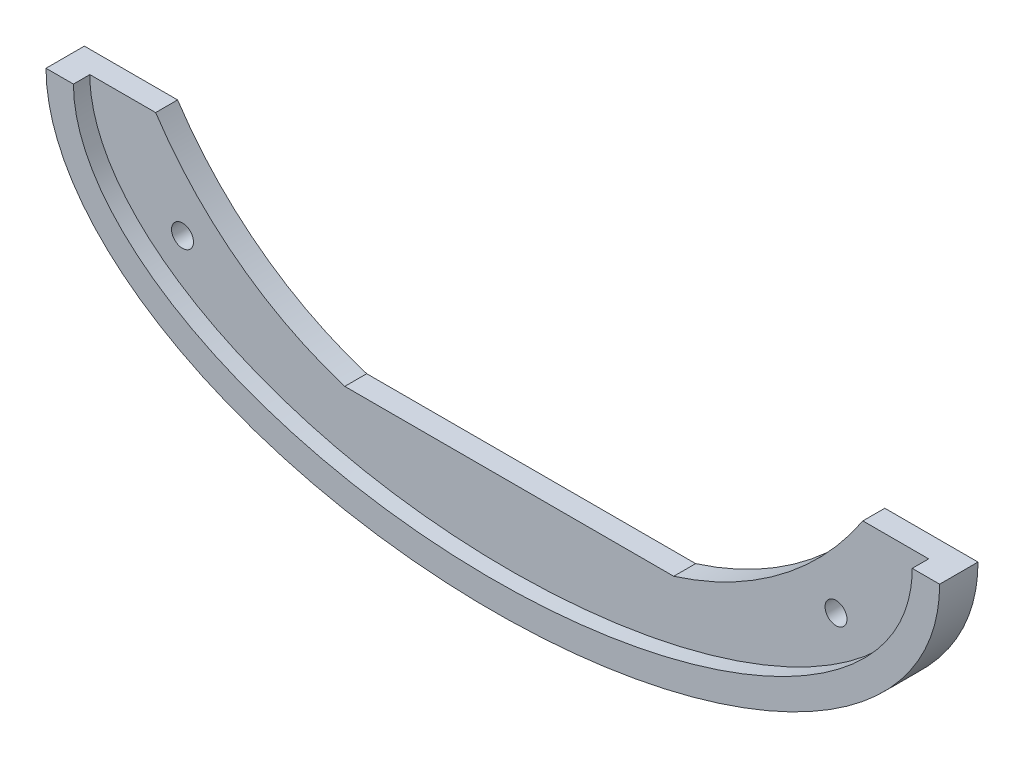
from build123d import *

# Parameters (mm, degrees)
CROQUIS1_R                 = 2
SALIENTE_EXTRUIR1_DEPTH    = 4
CROQUIS2_R                 = 2
SALIENTE_EXTRUIR2_DEPTH    = 4
SALIENTE_EXTRUIR3_START    = -11
SALIENTE_EXTRUIR3_DEPTH    = 11
SALIENTE_EXTRUIR4_DEPTH    = 4
CROQUIS5_W                 = 81.51
CROQUIS5_H                 = 4
SALIENTE_EXTRUIR5_DEPTH    = 45
CROQUIS6_R                 = 8.15
CROQUIS6_R_2               = 8.125
CROQUIS6_R_3               = 2.65
CORTAR_EXTRUIR1_DEPTH      = 25
SALIENTE_EXTRUIR9_START    = 2
CROQUIS17_RX               = 3.839992974
CROQUIS17_RY               = 1.30664232
SALIENTE_EXTRUIR9_DEPTH    = 2
CORTAR_EXTRUIR9_DEPTH      = 104.166128328
CORTAR_EXTRUIR9_DEPTH_BACK = 104.166128328
CROQUIS20_W                = 49.659393266
CROQUIS20_H                = 45
SALIENTE_EXTRUIR11_START   = -4
CROQUIS21_R                = 2
SALIENTE_EXTRUIR11_DEPTH   = 4


with BuildPart() as part:
    # Croquis1 → Saliente-Extruir1 (new body)
    with BuildSketch(Plane.XY):
        with BuildLine():
            Line((0, 14), (30, 14))
            ThreePointArc((30, 14), (49.490442899, 24.027104614), (64.5, 40))
            Line((64.5, 40), (76.5, 40))
            add(Edge.make_bspline(
                [(-76.5, 40), (-76.5, 0), (0, 0), (76.5, 0), (76.5, 40)],
                knots=[3.141592654, 3.141592654, 3.141592654, 4.71238898, 4.71238898, 6.283185307, 6.283185307, 6.283185307], degree=2, weights=[1, 0.707106781, 1, 0.707106781, 1]))
            Line((-76.5, 40), (-64.5, 40))
            ThreePointArc((-64.5, 40), (-49.490442899, 24.027104614), (-30, 14))
            Line((-30, 14), (0, 14))
        make_face()
        with Locations(Location((7.25, 8, 0), (0, 0, 180))):
            Circle(CROQUIS1_R, mode=Mode.SUBTRACT)
        with Locations(Location((59.6, 23, 0), (0, 0, 180))):
            Circle(CROQUIS1_R, mode=Mode.SUBTRACT)
        with Locations((-7.25, 8)):
            Circle(CROQUIS1_R, mode=Mode.SUBTRACT)
        with Locations((-59.6, 23)):
            Circle(CROQUIS1_R, mode=Mode.SUBTRACT)
    extrude(amount=SALIENTE_EXTRUIR1_DEPTH)



with BuildPart() as body_2:
    # Croquis2 → Saliente-Extruir2 (new body)
    with BuildSketch(Plane(origin=(0, 0, -3), x_dir=(-1, 0, 0), z_dir=(0, 0, -1))):
        with BuildLine():
            Line((64.5, 40), (76.5, 40))
            add(Edge.make_bspline(
                [(-76.5, 40), (-76.5, 0), (0, 0), (76.5, 0), (76.5, 40)],
                knots=[0, 0, 0, 1.570796327, 1.570796327, 3.141592654, 3.141592654, 3.141592654], degree=2, weights=[1, 0.707106781, 1, 0.707106781, 1]))
            Line((-76.5, 40), (-64.5, 40))
            ThreePointArc((-64.5, 40), (-49.490442899, 24.027104614), (-30, 14))
            Line((-30, 14), (30, 14))
            ThreePointArc((30, 14), (49.490442899, 24.027104614), (64.5, 40))
        make_face()
        with Locations((-59.6, 23)):
            Circle(CROQUIS2_R, mode=Mode.SUBTRACT)
        with Locations(Location((7.25, 8, 0), (0, 0, 180))):
            Circle(CROQUIS2_R, mode=Mode.SUBTRACT)
        with Locations((-7.25, 8)):
            Circle(CROQUIS2_R, mode=Mode.SUBTRACT)
        with Locations(Location((59.6, 23, 0), (0, 0, 180))):
            Circle(CROQUIS2_R, mode=Mode.SUBTRACT)
    extrude(amount=SALIENTE_EXTRUIR2_DEPTH)


with BuildPart() as part_1:
    add(part.part)

    add(body_2.part)  # Saliente-Extruir3 merges body 2
    # Croquis3 → Saliente-Extruir3 (add)
    with BuildSketch(Plane.XY.offset(4).offset(SALIENTE_EXTRUIR3_START)):
        with BuildLine():
            Line((-81.5, 40), (-76.5, 40))
            add(Edge.make_bspline(
                [(-76.5, 40), (-76.5, 0), (0, 0), (76.5, 0), (76.5, 40)],
                knots=[3.141592654, 3.141592654, 3.141592654, 4.71238898, 4.71238898, 6.283185307, 6.283185307, 6.283185307], degree=2, weights=[1, 0.707106781, 1, 0.707106781, 1]))
            Line((76.5, 40), (81.5, 40))
            add(Edge.make_bspline(
                [(-81.5, 40), (-81.5, 36.750529527), (-80.260995736, 30.280968201), (-73.321740908, 18.442769728), (-57.739765713, 6.428777931), (-31.065541534, -2.851449154), (0, -6.074275423), (31.065541534, -2.851449154), (57.739765713, 6.428777931), (73.321740908, 18.442769728), (80.260995736, 30.280968201), (81.5, 36.750529527), (81.5, 40)],
                knots=[3.141592654, 3.141592654, 3.141592654, 3.141592654, 3.337942194, 3.534291735, 3.926990817, 4.319689899, 4.71238898, 5.105088062, 5.497787144, 5.890486225, 6.086835766, 6.283185307, 6.283185307, 6.283185307, 6.283185307], degree=3))
        make_face()
    extrude(amount=SALIENTE_EXTRUIR3_DEPTH)

    # Croquis4 → Saliente-Extruir4 (add)
    with BuildSketch(Plane.XY):
        with BuildLine():
            Line((30, 14), (-30, 14))
            ThreePointArc((-30, 14), (-34.993144069, 15.797887582), (-39.821662304, 18))
            Line((-39.821662304, 18), (39.821662304, 18))
            ThreePointArc((39.821662304, 18), (34.993144069, 15.797887582), (30, 14))
        make_face()
    extrude(amount=SALIENTE_EXTRUIR4_DEPTH)

    # Croquis5 → Saliente-Extruir5 (add)
    with BuildSketch(Plane.XY.offset(4)):
        with Locations((0, 16)):
            Rectangle(CROQUIS5_W, CROQUIS5_H)
    extrude(amount=SALIENTE_EXTRUIR5_DEPTH)

    # Croquis6 → Cortar-Extruir1 (cut)
    with BuildSketch(Plane(origin=(0, 14, 0), x_dir=(-1, 0, 0), z_dir=(0, -1, 0))):
        with Locations(Location((13.075, -29, 0), (0, 0, 180))):
            Circle(CROQUIS6_R)
        with Locations(Location((-13.075, -29, 0), (0, 0, 180))):
            Circle(CROQUIS6_R_2)
        with Locations(Location((35.825963914, -43.403403929, 0), (0, 0, 180))):
            Circle(CROQUIS6_R_3)
        with Locations(Location((35.825963914, -33.403403929, 0), (0, 0, 180))):
            Circle(CROQUIS6_R_3)
        with Locations(Location((-35.825963914, -33.403403929, 0), (0, 0, 90))):
            Circle(CROQUIS6_R_3)
        with Locations(Location((-35.825963914, -43.403403929, 0), (0, 0, 90))):
            Circle(CROQUIS6_R_3)
    extrude(amount=-CORTAR_EXTRUIR1_DEPTH, mode=Mode.SUBTRACT)

    # Croquis17 → Saliente-Extruir9 (add)
    with BuildSketch(Plane.XZ.offset(-14).offset(SALIENTE_EXTRUIR9_START)):
        with Locations((-0.038170425, 20.627419709)):
            Ellipse(CROQUIS17_RX, CROQUIS17_RY)
        with BuildLine():
            Line((-20.599642293, 38.80557826), (-14.876279709, 42.835853775))
            ThreePointArc((-14.876279709, 42.835853775), (-13.482902837, 42.593984193), (-13.724772419, 41.200607322))
            Line((-13.724772419, 41.200607322), (-19.448135003, 37.170331807))
            ThreePointArc((-19.448135003, 37.170331807), (-20.841511875, 37.412201388), (-20.599642293, 38.80557826))
        make_face()
        with BuildLine():
            Line((14.79993886, 42.835853775), (20.523301444, 38.80557826))
            ThreePointArc((20.523301444, 38.80557826), (20.765171026, 37.412201388), (19.371794154, 37.170331807))
            Line((19.371794154, 37.170331807), (13.64843157, 41.200607322))
            ThreePointArc((13.64843157, 41.200607322), (13.406561988, 42.593984193), (14.79993886, 42.835853775))
        make_face()
        with BuildLine():
            ThreePointArc((-20.851449027, 31.439127003), (-21.115075712, 30.334047429), (-21.222470325, 29.203045089))
            add(Edge.make_bspline(
                [(-25.476510975, 33.88579792), (-24.936658507, 29.766870668), (-23.959082251, 29.798200281), (-21.222470325, 29.203045089)],
                knots=[0, 0, 0, 0, 0.707855223, 0.707855223, 0.707855223, 0.707855223], degree=3))
            add(Edge.make_bspline(
                [(-20.851449027, 31.439127003), (-23.607664548, 31.252260239), (-25.476510975, 33.88579792)],
                knots=[0, 0, 0, 1, 1, 1], degree=2))
        make_face()
        with BuildLine():
            ThreePointArc((-10.806585595, 17.555254071), (0.181750729, 15.470071818), (11.170087054, 17.555254071))
            ThreePointArc((11.170087054, 17.555254071), (11.818495985, 17.273179866), (11.53642178, 16.624770934))
            ThreePointArc((11.53642178, 16.624770934), (0.181750729, 14.470071818), (-11.172920321, 16.624770934))
            ThreePointArc((-11.172920321, 16.624770934), (-11.454994527, 17.273179866), (-10.806585595, 17.555254071))
        make_face()
        with BuildLine():
            ThreePointArc((20.775108177, 31.439127003), (21.038734863, 30.334047429), (21.146129476, 29.203045089))
            add(Edge.make_bspline(
                [(25.400170126, 33.88579792), (24.860317658, 29.766870668), (23.882741402, 29.798200281), (21.146129476, 29.203045089)],
                knots=[0, 0, 0, 0, 0.707855223, 0.707855223, 0.707855223, 0.707855223], degree=3))
            add(Edge.make_bspline(
                [(20.775108177, 31.439127003), (23.531323698, 31.252260239), (25.400170126, 33.88579792)],
                knots=[0, 0, 0, 1, 1, 1], degree=2))
        make_face()
    extrude(amount=-SALIENTE_EXTRUIR9_DEPTH)

    # Croquis20 → Cortar-Extruir9 (cut, two sides: drawn at the far end of the back side and taken through both)
    with BuildSketch(Plane(origin=(0, 0, 0), x_dir=(0, 0, -1), z_dir=(1, 0, 0)).offset(-CORTAR_EXTRUIR9_DEPTH_BACK)):
        with Locations((-24.829696633, 17.5)):
            Rectangle(CROQUIS20_W, CROQUIS20_H)
    extrude(amount=CORTAR_EXTRUIR9_DEPTH + CORTAR_EXTRUIR9_DEPTH_BACK, mode=Mode.SUBTRACT)

    # Croquis21 → Saliente-Extruir11 (add)
    with BuildSketch(Plane(origin=(0, 0, -7), x_dir=(-1, 0, 0), z_dir=(0, 0, -1)).offset(SALIENTE_EXTRUIR11_START)):
        with Locations((-7.25, 8)):
            Circle(CROQUIS21_R)
        with Locations((7.25, 8)):
            Circle(CROQUIS21_R)
    extrude(amount=SALIENTE_EXTRUIR11_DEPTH)


solid = part_1.part
